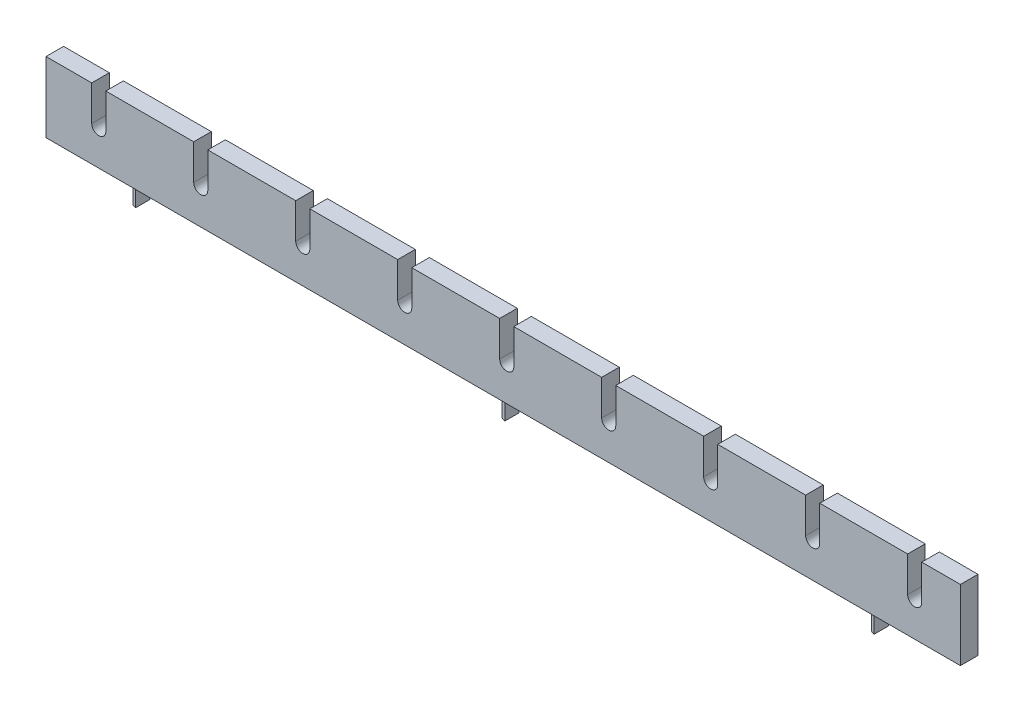
from build123d import *

# Parameters (mm, degrees)
SKETCH1_W           = 330.2
SKETCH1_H           = 6.35
BOSS_EXTRUDE1_DEPTH = 25.4
BOSS_EXTRUDE2_DEPTH = 6.35
CUT_EXTRUDE1_DEPTH  = 168.16307158


with BuildPart() as part:
    # Sketch1 → Boss-Extrude1 (new body)
    with BuildSketch(Plane(origin=(0, 0, 0), x_dir=(1, 0, 0), z_dir=(0, 1, 0))):
        Rectangle(SKETCH1_W, SKETCH1_H)
    extrude(amount=BOSS_EXTRUDE1_DEPTH)

    # Sketch2 → Boss-Extrude2 (add)
    with BuildSketch(Plane.XZ):
        with BuildLine():
            Line((-133.35, 2.54), (-133.35, -2.54))
            ThreePointArc((-133.35, -2.54), (-135.89, 0), (-133.35, 2.54))
        make_face()
        with BuildLine():
            Line((0, 2.54), (0, -2.54))
            ThreePointArc((0, -2.54), (-2.54, 0), (0, 2.54))
        make_face()
        with BuildLine():
            Line((133.35, 2.54), (133.35, -2.54))
            ThreePointArc((133.35, -2.54), (130.81, 0), (133.35, 2.54))
        make_face()
    extrude(amount=BOSS_EXTRUDE2_DEPTH)

    # Sketch3 → Cut-Extrude1 (cut, through all)
    with BuildSketch(Plane.XY.offset(3.175)):
        with BuildLine():
            Line((-143.51, 38.1), (-143.51, 12.7))
            ThreePointArc((-143.51, 12.7), (-146.05, 10.16), (-148.59, 12.7))
            Line((-148.59, 12.7), (-148.59, 38.1))
            ThreePointArc((-148.59, 38.1), (-146.05, 40.64), (-143.51, 38.1))
        make_face()
        with BuildLine():
            Line((-106.68, 38.1), (-106.68, 12.7))
            ThreePointArc((-106.68, 12.7), (-109.22, 10.16), (-111.76, 12.7))
            Line((-111.76, 12.7), (-111.76, 38.1))
            ThreePointArc((-111.76, 38.1), (-109.22, 40.64), (-106.68, 38.1))
        make_face()
        with BuildLine():
            Line((-69.85, 38.1), (-69.85, 12.7))
            ThreePointArc((-69.85, 12.7), (-72.39, 10.16), (-74.93, 12.7))
            Line((-74.93, 12.7), (-74.93, 38.1))
            ThreePointArc((-74.93, 38.1), (-72.39, 40.64), (-69.85, 38.1))
        make_face()
        with BuildLine():
            Line((-33.02, 38.1), (-33.02, 12.7))
            ThreePointArc((-33.02, 12.7), (-35.56, 10.16), (-38.1, 12.7))
            Line((-38.1, 12.7), (-38.1, 38.1))
            ThreePointArc((-38.1, 38.1), (-35.56, 40.64), (-33.02, 38.1))
        make_face()
        with BuildLine():
            Line((3.81, 38.1), (3.81, 12.7))
            ThreePointArc((3.81, 12.7), (1.27, 10.16), (-1.27, 12.7))
            Line((-1.27, 12.7), (-1.27, 38.1))
            ThreePointArc((-1.27, 38.1), (1.27, 40.64), (3.81, 38.1))
        make_face()
        with BuildLine():
            Line((40.64, 38.1), (40.64, 12.7))
            ThreePointArc((40.64, 12.7), (38.1, 10.16), (35.56, 12.7))
            Line((35.56, 12.7), (35.56, 38.1))
            ThreePointArc((35.56, 38.1), (38.1, 40.64), (40.64, 38.1))
        make_face()
        with BuildLine():
            Line((77.47, 38.1), (77.47, 12.7))
            ThreePointArc((77.47, 12.7), (74.93, 10.16), (72.39, 12.7))
            Line((72.39, 12.7), (72.39, 38.1))
            ThreePointArc((72.39, 38.1), (74.93, 40.64), (77.47, 38.1))
        make_face()
        with BuildLine():
            Line((114.3, 38.1), (114.3, 12.7))
            ThreePointArc((114.3, 12.7), (111.76, 10.16), (109.22, 12.7))
            Line((109.22, 12.7), (109.22, 38.1))
            ThreePointArc((109.22, 38.1), (111.76, 40.64), (114.3, 38.1))
        make_face()
        with BuildLine():
            Line((151.13, 38.1), (151.13, 12.7))
            ThreePointArc((151.13, 12.7), (148.59, 10.16), (146.05, 12.7))
            Line((146.05, 12.7), (146.05, 38.1))
            ThreePointArc((146.05, 38.1), (148.59, 40.64), (151.13, 38.1))
        make_face()
    extrude(amount=-CUT_EXTRUDE1_DEPTH, mode=Mode.SUBTRACT)


solid = part.part
